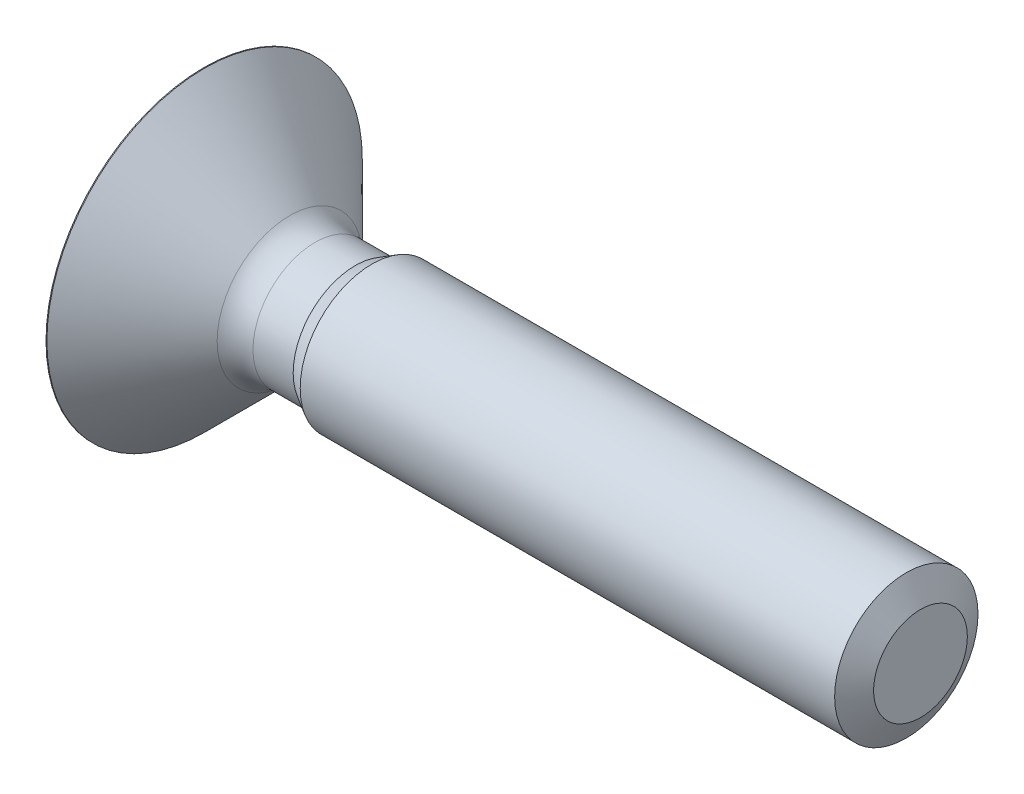
from build123d import *

# Parameters (mm, degrees)
PATTERN_CIRCULAR_1_COUNT = 2
PATTERN_CIRCULAR_1_ANGLE = 90


with BuildPart() as part:
    # 草图1 → Revolve 766 (revolve)
    with BuildSketch(Plane.XY, mode=Mode.PRIVATE) as revolve_766_sk:
        with BuildLine():
            Line((0, 0), (0, 2.2))
            Line((0, 2.2), (0.012446609, 2.2))
            Line((0.012446609, 2.2), (1.2, 1.012446609))
            ThreePointArc((1.2, 1.012446609), (1.362211674, 0.904060234), (1.553553391, 0.866))
            Line((1.553553391, 0.866), (2.114351801, 0.866))
            Line((2.114351801, 0.866), (2.346446609, 1))
            Line((2.346446609, 1), (10, 1))
            Line((10, 1), (10, 0))
            Line((10, 0), (0, 0))
        make_face()
    revolve(revolve_766_sk.sketch.rotate(Axis((0, 0, 0), (1, 0, 0)), 90), axis=Axis((0, 0, 0), (1, 0, 0)))

    # 草图2 → 切除-旋转1 (revolve, cut)
    with BuildSketch(Plane.XY, mode=Mode.PRIVATE) as cut_revolve_1_sk:
        Polygon((9.802166402, 1), (10.202166402, 1), (10, 0.6536), align=None)
    revolve(cut_revolve_1_sk.sketch.rotate(Axis((0, 0, 0), (-1, 0, 0)), 270), axis=Axis((0, 0, 0), (-1, 0, 0)), mode=Mode.SUBTRACT)

    # 草图3 → 切除-放样1 section 0
    with BuildSketch(Plane.ZY, mode=Mode.PRIVATE) as loft_1_s0:
        with BuildLine():
            Line((-1.1, 0.2), (1.1, 0.2))
            Line((1.1, 0.2), (1.1, -0.2))
            Line((1.1, -0.2), (-1.1, -0.2))
            Line((-1.1, -0.2), (-1.1, 0.2))
        make_face()
    loft_1 = loft([loft_1_s0.sketch, Vertex(1.2, 0, 0)], mode=Mode.SUBTRACT)

    # 阵列(圆周)1: 切除-放样1 ×2 about axis
    pattern_circular_1_axis = Axis((0, 0, 0), (1, 0, 0))
    for i in range(1, PATTERN_CIRCULAR_1_COUNT):
        add(loft_1.rotate(pattern_circular_1_axis, i * PATTERN_CIRCULAR_1_ANGLE / (PATTERN_CIRCULAR_1_COUNT - 1)), mode=Mode.SUBTRACT)


solid = part.part
